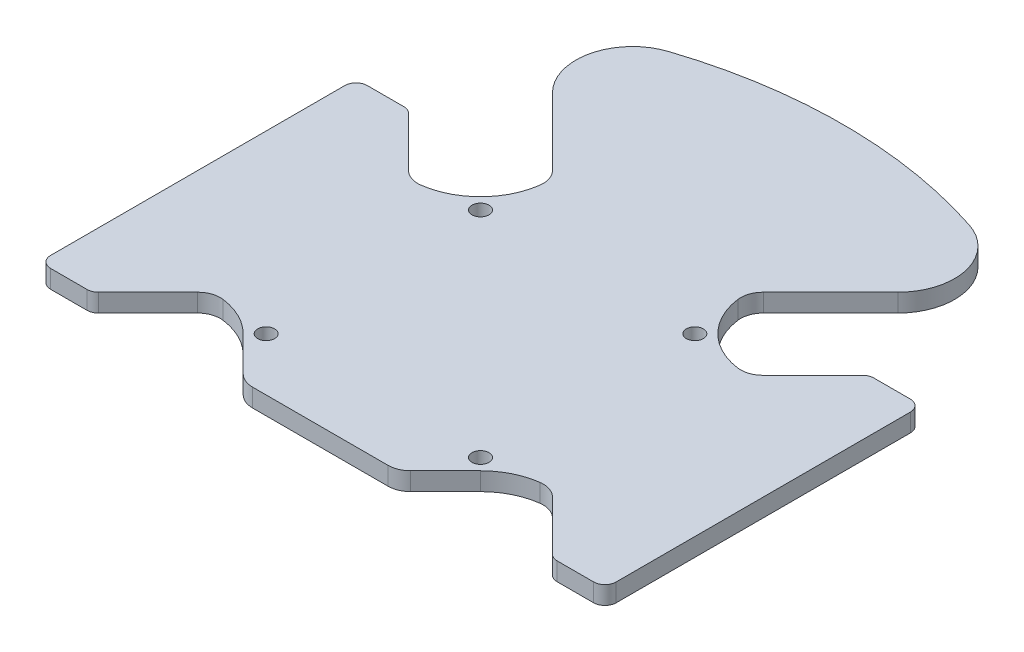
from build123d import *

# Parameters (mm, degrees)
SKETCH1_R           = 0.75
BOSS_EXTRUDE1_DEPTH = 1.6


with BuildPart() as part:
    # Sketch1 → Boss-Extrude1 (new body)
    with BuildSketch(Plane(origin=(0, 0, 0), x_dir=(1, 0, 0), z_dir=(0, 1, 0))):
        with BuildLine():
            Line((-20.071067812, -13.707106781), (-15.681770053, -9.317809022))
            ThreePointArc((-15.681770053, -9.317809022), (-14.907327841, -8.837110286), (-14, -8.75))
            ThreePointArc((-14, -8.75), (-12.101565565, -9.330988792), (-10.488732177, -10.488732177))
            Line((-10.488732177, -10.488732177), (-7.402704805, -13.57475955))
            ThreePointArc((-7.402704805, -13.57475955), (-6.753858107, -14.008305053), (-5.988491243, -14.160545988))
            Line((-5.988491243, -14.160545988), (5.988491243, -14.160545988))
            ThreePointArc((5.988491243, -14.160545988), (6.753858107, -14.008305053), (7.402704805, -13.57475955))
            Line((7.402704805, -13.57475955), (10.488732177, -10.488732177))
            ThreePointArc((10.488732177, -10.488732177), (12.101565565, -9.330988792), (14, -8.75))
            ThreePointArc((14, -8.75), (14.907327841, -8.837110286), (15.681770053, -9.317809022))
            Line((15.681770053, -9.317809022), (20.071067812, -13.707106781))
            ThreePointArc((20.071067812, -13.707106781), (20.395491161, -13.923879533), (20.778174593, -14))
            Line((20.778174593, -14), (24, -14))
            ThreePointArc((24, -14), (24.707106781, -13.707106781), (25, -13))
            Line((25, -13), (25, 13))
            ThreePointArc((25, 13), (24.707106781, 13.707106781), (24, 14))
            Line((24, 14), (20.778174593, 14))
            ThreePointArc((20.778174593, 14), (20.395491161, 13.923879533), (20.071067812, 13.707106781))
            Line((20.071067812, 13.707106781), (15.681770053, 9.317809022))
            ThreePointArc((15.681770053, 9.317809022), (14.907327841, 8.837110286), (14, 8.75))
            ThreePointArc((14, 8.75), (10.488732177, 10.488732177), (8.75, 14))
            ThreePointArc((8.75, 14), (8.837110286, 14.907327841), (9.317809022, 15.681770053))
            Line((9.317809022, 15.681770053), (15.27484739, 21.638808421))
            ThreePointArc((15.27484739, 21.638808421), (16.603119619, 26.333389297), (13.300387568, 29.924399979))
            ThreePointArc((13.300387568, 29.924399979), (0, 32.053914601), (-13.300387568, 29.924399979))
            ThreePointArc((-13.300387568, 29.924399979), (-16.603119619, 26.333389297), (-15.27484739, 21.638808421))
            Line((-15.27484739, 21.638808421), (-9.317809022, 15.681770053))
            ThreePointArc((-9.317809022, 15.681770053), (-8.837110286, 14.907327841), (-8.75, 14))
            ThreePointArc((-8.75, 14), (-10.488732177, 10.488732177), (-14, 8.75))
            ThreePointArc((-14, 8.75), (-14.907327841, 8.837110286), (-15.681770053, 9.317809022))
            Line((-15.681770053, 9.317809022), (-20.071067812, 13.707106781))
            ThreePointArc((-20.071067812, 13.707106781), (-20.395491161, 13.923879533), (-20.778174593, 14))
            Line((-20.778174593, 14), (-24, 14))
            ThreePointArc((-24, 14), (-24.707106781, 13.707106781), (-25, 13))
            Line((-25, 13), (-25, -13))
            ThreePointArc((-25, -13), (-24.707106781, -13.707106781), (-24, -14))
            Line((-24, -14), (-20.778174593, -14))
            ThreePointArc((-20.778174593, -14), (-20.395491161, -13.923879533), (-20.071067812, -13.707106781))
        make_face()
        with Locations((-9.475230868, 9.475230868)):
            Circle(SKETCH1_R, mode=Mode.SUBTRACT)
        with Locations((9.475230868, -9.475230868)):
            Circle(SKETCH1_R, mode=Mode.SUBTRACT)
        with Locations((9.475230868, 9.475230868)):
            Circle(SKETCH1_R, mode=Mode.SUBTRACT)
        with Locations((-9.475230868, -9.475230868)):
            Circle(SKETCH1_R, mode=Mode.SUBTRACT)
    extrude(amount=BOSS_EXTRUDE1_DEPTH)


solid = part.part
